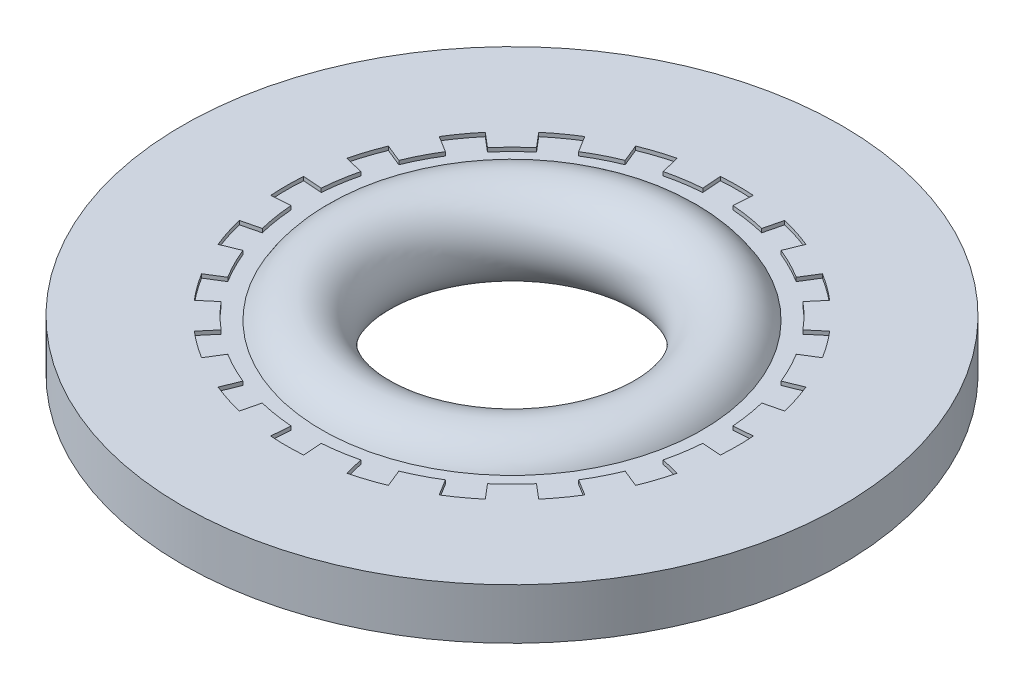
from build123d import *

# Parameters (mm, degrees)
SKETCH2_W          = 1.8504408
SKETCH2_H          = 0.762
CUT_EXTRUDE1_DEPTH = 8.045925205
CIRPATTERN1_COUNT  = 20


with BuildPart() as part:
    # Sketch2 → Revolve1 (revolve)
    with BuildSketch(Plane.XY, mode=Mode.PRIVATE) as revolve1_sk:
        with Locations((-4.0277796, 0)):
            Rectangle(SKETCH2_W, SKETCH2_H)
    revolve(revolve1_sk.sketch.rotate(Axis((0, 0, 0), (0, 1, 0)), 270), axis=Axis((0, 0, 0), (0, 1, 0)))

    # Sketch3 → Cut-Extrude1 (cut, through all)
    with BuildSketch(Plane(origin=(0, 0.381, 0), x_dir=(1, 0, 0), z_dir=(0, 1, 0))):
        with BuildLine():
            Line((-0.226761261, 3.094261288), (-0.24765, 3.379297703))
            ThreePointArc((-0.24765, 3.379297703), (0, 3.38836), (0.24765, 3.379297703))
            Line((0.24765, 3.379297703), (0.226761261, 3.094261288))
            ThreePointArc((0.226761261, 3.094261288), (0, 3.1025592), (-0.226761261, 3.094261288))
        make_face()
    cut_extrude1 = extrude(amount=-CUT_EXTRUDE1_DEPTH, mode=Mode.SUBTRACT)

    # CirPattern1: Cut-Extrude1 ×20 about axis
    cirpattern1_axis = Axis((0, 0, 0), (0, 1, 0))
    for i in range(1, CIRPATTERN1_COUNT):
        add(cut_extrude1.rotate(cirpattern1_axis, i * 360 / CIRPATTERN1_COUNT), mode=Mode.SUBTRACT)

    # Sketch4 → Revolve2 (revolve)
    with BuildSketch(Plane.XY, mode=Mode.PRIVATE) as revolve2_sk:
        with BuildLine():
            Line((-3.38836, -0.32385), (-2.859624654, -0.32385))
            ThreePointArc((-2.859624654, -0.32385), (-1.651, 0), (-2.859624654, 0.32385))
            Line((-2.859624654, 0.32385), (-3.38836, 0.32385))
            Line((-3.38836, 0.32385), (-3.38836, -0.32385))
        make_face()
    revolve(revolve2_sk.sketch.rotate(Axis((0, 0, 0), (0, 1, 0)), 270), axis=Axis((0, 0, 0), (0, 1, 0)))


solid = part.part
